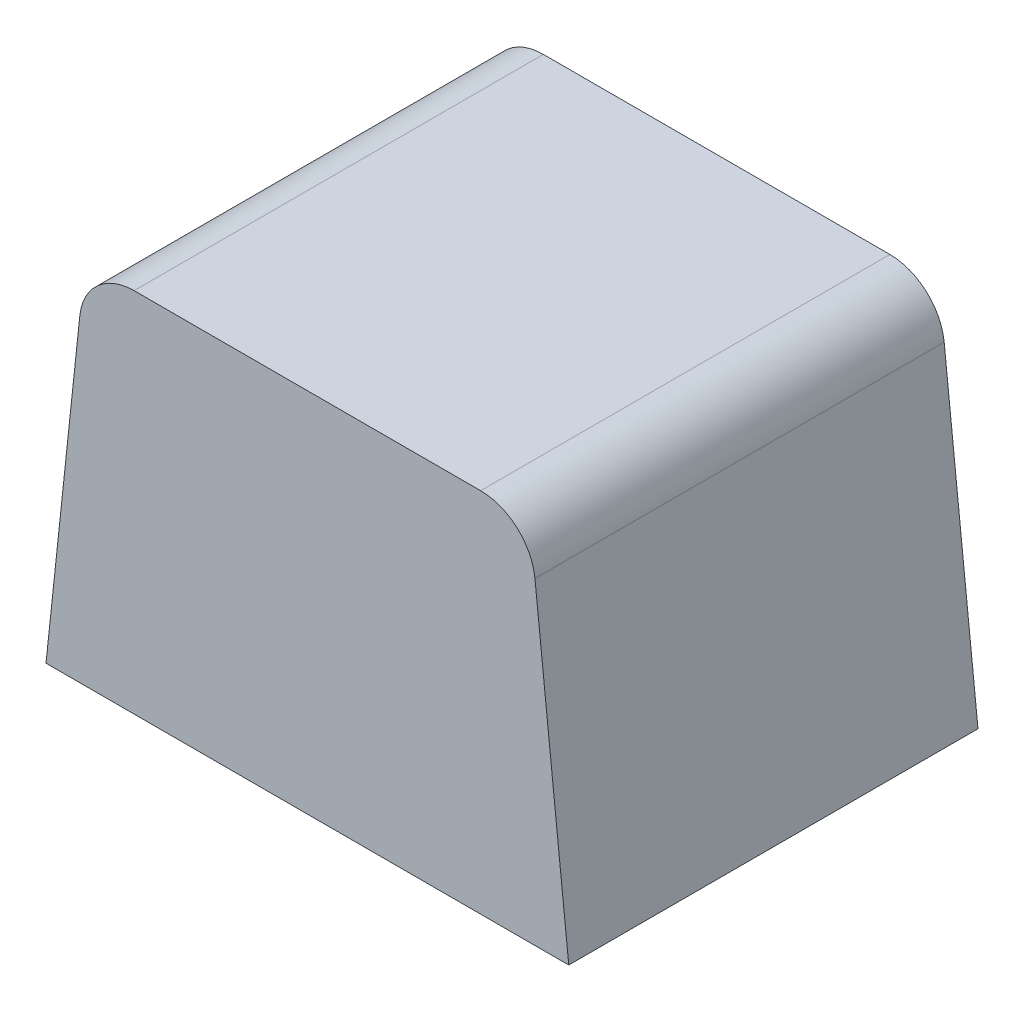
from build123d import *

# Parameters (mm, degrees)
BOSS_EXTRUDE3_DEPTH = 370
SKETCH3_W           = 569.98245323
SKETCH3_H           = 524.5
BOSS_EXTRUDE4_DEPTH = 100
BOSS_EXTRUDE5_DEPTH = 524.5
FILLET3_R           = 70


with BuildPart() as part:
    # Sketch1 → Boss-Extrude3 (new body)
    with BuildSketch(Plane(origin=(0, 0, 0), x_dir=(1, 0, 0), z_dir=(0, 1, 0))):
        Polygon((225.65, -262.25), (344.33245323, -262.25), (344.33245323, 262.25), (225.65, 262.25), (-225.65, 262.25), (-225.65, -262.25), align=None)
    extrude(amount=BOSS_EXTRUDE3_DEPTH)

    # Sketch3 → Boss-Extrude4 (add)
    with BuildSketch(Plane(origin=(0, 370, 0), x_dir=(1, 0, 0), z_dir=(0, 1, 0))):
        with Locations((59.341226615, 0)):
            Rectangle(SKETCH3_W, SKETCH3_H)
    extrude(amount=BOSS_EXTRUDE4_DEPTH)

    # Sketch6 → Boss-Extrude5 (add, through all)
    with BuildSketch(Plane.XY.offset(262.25)):
        Polygon((-225.65, 0), (-275.65, 0), (-225.65, 470), (344.33245323, 470), (394.33245323, 0), (344.33245323, 0), align=None)
    extrude(amount=-BOSS_EXTRUDE5_DEPTH)

    # Fillet3
    fillet3_edges = [part.edges().sort_by_distance(p)[0] for p in [
        (-225.65, 470, 0),
        (344.33245323, 470, 0),
    ]]
    fillet(fillet3_edges, radius=FILLET3_R)


solid = part.part
